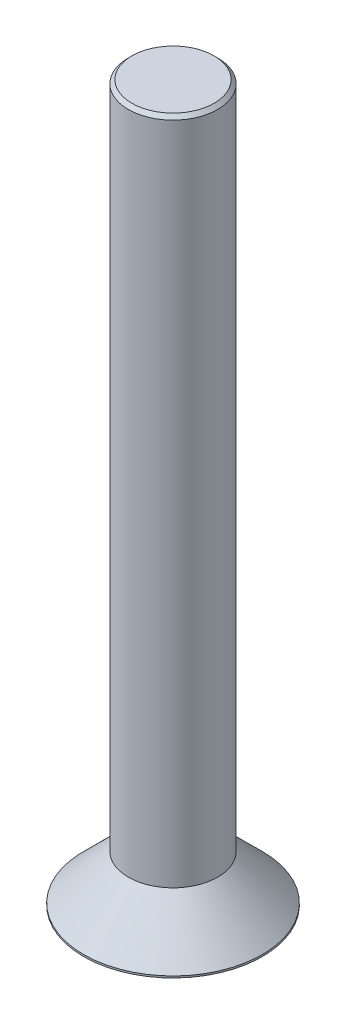
from build123d import *

# Parameters (mm, degrees)
SKETCH_1_R          = 5
EXTRUDE_1_DEPTH     = 2.6
CHAMFER_1_SIZE      = 2.5
CUT_EXTRUDE_1_DEPTH = 0.95
SKETCH_3_R          = 2.5
EXTRUDE_2_DEPTH     = 37.4
CHAMFER_2_SIZE      = 0.2


with BuildPart() as part:
    # 草图1 → 凸台-拉伸1 (new body)
    with BuildSketch(Plane(origin=(0, 0, 0), x_dir=(1, 0, 0), z_dir=(0, 1, 0))):
        with Locations(Location((0, 0, 0), (0, 0, 270))):
            Circle(SKETCH_1_R)
    extrude(amount=EXTRUDE_1_DEPTH)

    # 倒角1
    chamfer_1_edges = [part.edges().sort_by_distance(p)[0] for p in [
        (0, 2.6, -5),
    ]]
    chamfer(chamfer_1_edges, length=CHAMFER_1_SIZE)

    # 草图2 → 切除-拉伸1 (cut)
    with BuildSketch(Plane.XZ):
        Polygon((1.54, -0.889119415), (1.54, 0.889119415), (0, 1.778238829), (-1.54, 0.889119415), (-1.54, -0.889119415), (0, -1.778238829), align=None)
    extrude(amount=-CUT_EXTRUDE_1_DEPTH, mode=Mode.SUBTRACT)

    # 草图3 → 凸台-拉伸2 (add)
    with BuildSketch(Plane(origin=(0, 2.6, 0), x_dir=(1, 0, 0), z_dir=(0, 1, 0))):
        with Locations(Location((0, 0, 0), (0, 0, 270))):
            Circle(SKETCH_3_R)
    extrude(amount=EXTRUDE_2_DEPTH)

    # 倒角2
    chamfer_2_edges = [part.edges().sort_by_distance(p)[0] for p in [
        (0, 40, -2.5),
    ]]
    chamfer(chamfer_2_edges, length=CHAMFER_2_SIZE)


solid = part.part
